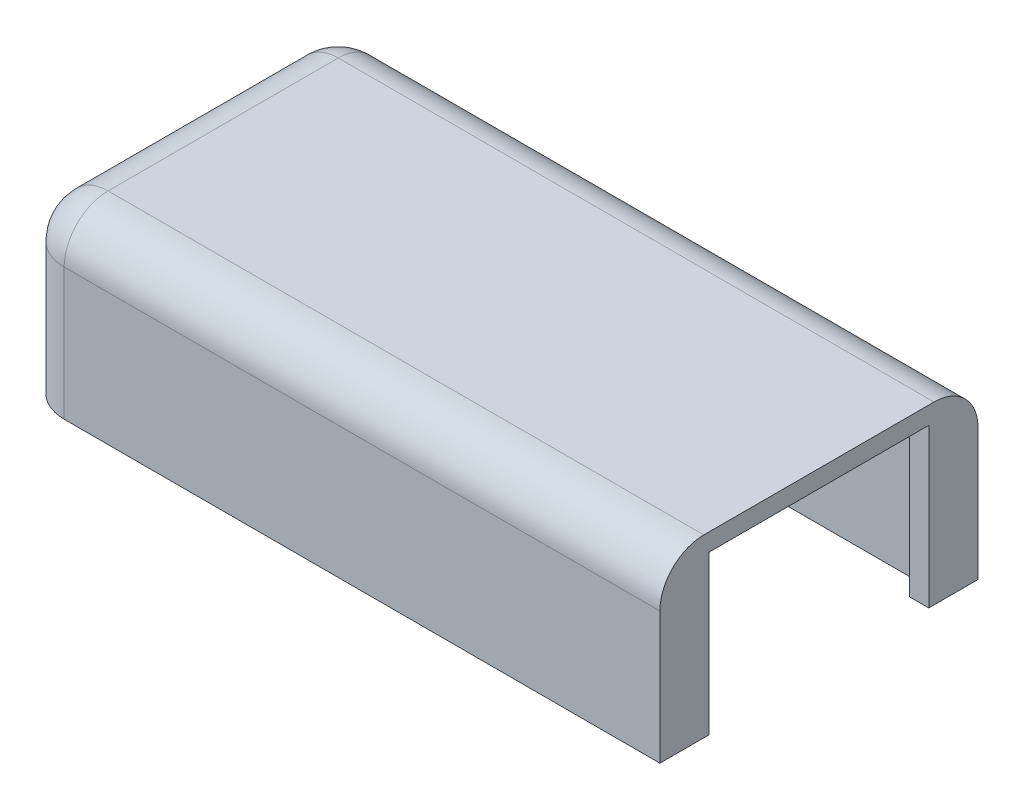
from build123d import *

# Parameters (mm, degrees)
SKETCH_1_W          = 72.2
SKETCH_1_H          = 36.2
SKETCH_1_W_2        = 65
SKETCH_1_H_2        = 29
EXTRUDE_1_DEPTH     = 20
SKETCH_2_W          = 29
SKETCH_2_H          = 20
CUT_EXTRUDE_1_DEPTH = 3.6
SKETCH_3_W          = 3.6
SKETCH_3_H          = 20
EXTRUDE_1_2_DEPTH   = 0.6
SKETCH_4_W          = 2.2
SKETCH_4_H          = 20
EXTRUDE_2_DEPTH     = 2
SKETCH_5_W          = 2.2
SKETCH_5_H          = 20
EXTRUDE_3_DEPTH     = 2
SKETCH_6_W          = 72.8
SKETCH_6_H          = 36.2
EXTRUDE_4_DEPTH     = 2
FILLET_1_R          = 5
FILLET_2_R          = 5
FILLET_3_R          = 5


with BuildPart() as part:
    # 草图1 → Extrude 1 (new body)
    with BuildSketch(Plane(origin=(0, 0, 0), x_dir=(1, 0, 0), z_dir=(0, 1, 0))):
        with Locations((32.5, 14.5)):
            Rectangle(SKETCH_1_W, SKETCH_1_H)
        with Locations((32.5, 14.5)):
            Rectangle(SKETCH_1_W_2, SKETCH_1_H_2, mode=Mode.SUBTRACT)
    extrude(amount=EXTRUDE_1_DEPTH)

    # 草图2 → 切除-拉伸1 (cut)
    with BuildSketch(Plane.ZY.offset(-65)):
        with Locations((-14.5, 10)):
            Rectangle(SKETCH_2_W, SKETCH_2_H)
    extrude(amount=-CUT_EXTRUDE_1_DEPTH, mode=Mode.SUBTRACT)

    # 草图3 → Extrude 1 2 (add)
    with BuildSketch(Plane(origin=(68.6, 0, 0), x_dir=(0, 0, -1), z_dir=(1, 0, 0))):
        with Locations((-1.8, 10)):
            Rectangle(SKETCH_3_W, SKETCH_3_H)
        with Locations((30.8, 10)):
            Rectangle(SKETCH_3_W, SKETCH_3_H)
    extrude(amount=EXTRUDE_1_2_DEPTH)

    # 草图4 → 凸台-拉伸2 (add)
    with BuildSketch(Plane(origin=(0, 0, 0), x_dir=(-1, 0, 0), z_dir=(0, 0, -1))):
        with Locations((-68.1, 10)):
            Rectangle(SKETCH_4_W, SKETCH_4_H)
    extrude(amount=EXTRUDE_2_DEPTH)

    # 草图5 → 凸台-拉伸3 (add)
    with BuildSketch(Plane.XY.offset(-29)):
        with Locations((68.1, 10)):
            Rectangle(SKETCH_5_W, SKETCH_5_H)
    extrude(amount=EXTRUDE_3_DEPTH)

    # 草图6 → 凸台-拉伸4 (add)
    with BuildSketch(Plane(origin=(0, 20, 0), x_dir=(1, 0, 0), z_dir=(0, 1, 0))):
        with Locations((32.8, 14.5)):
            Rectangle(SKETCH_6_W, SKETCH_6_H)
    extrude(amount=-EXTRUDE_4_DEPTH)

    # 圆角1
    fillet_1_edges = [part.edges().sort_by_distance(p)[0] for p in [
        (32.8, 20, -32.6),
    ]]
    fillet(fillet_1_edges, radius=FILLET_1_R)

    # 圆角2
    fillet_2_edges = [part.edges().sort_by_distance(p)[0] for p in [
        (32.8, 20, 3.6),
    ]]
    fillet(fillet_2_edges, radius=FILLET_2_R)

    # 圆角3
    fillet_3_edges = [part.edges().sort_by_distance(p)[0] for p in [
        (-3.6, 20, -14.5),
        (-3.6, 7.5, -32.6),
        (-3.6, 18.535533906, -31.135533906),
        (-3.6, 7.5, 3.6),
        (-3.6, 18.535533906, 2.135533906),
    ]]
    fillet(fillet_3_edges, radius=FILLET_3_R)


solid = part.part
